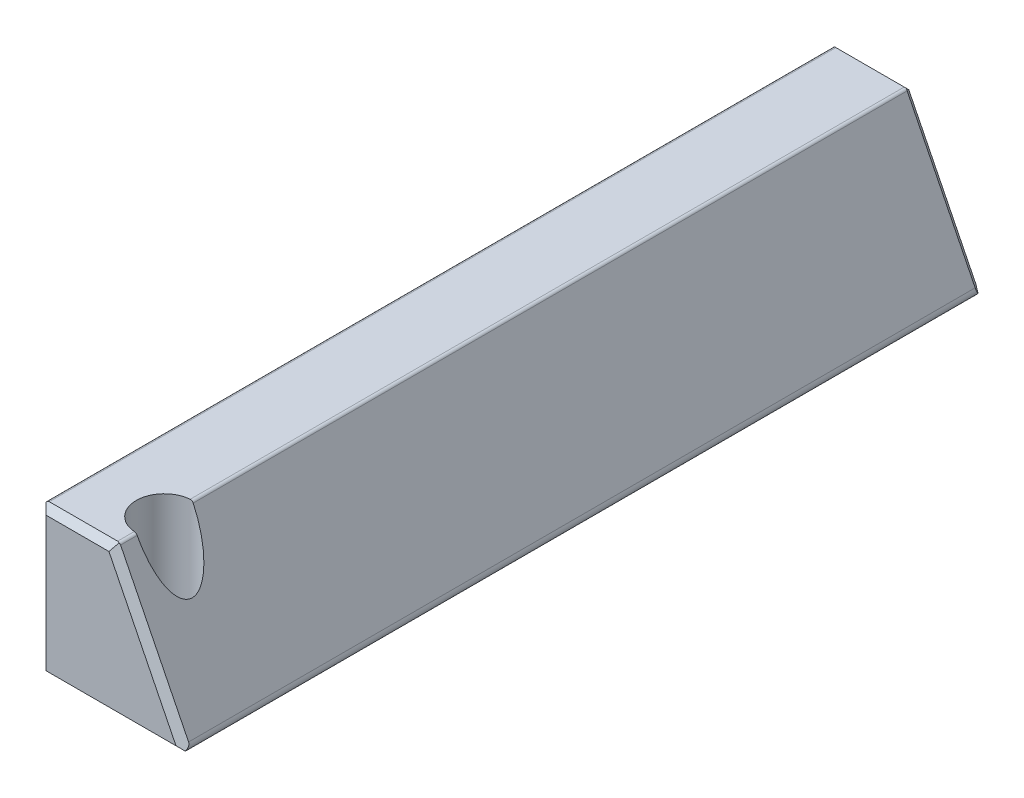
from build123d import *

# Parameters (mm, degrees)
BASE_DEPTH        = 60.25
FACE_CHAMFER_SIZE = 0.5
SMALLER_FILLETS_R = 0.25
LARGER_FILLET_R   = 0.5
SKETCH2_R         = 2.11
HOLE_DEPTH        = 63.216278519


with BuildPart() as part:
    # Sketch1 → Base (new body)
    with BuildSketch(Plane.XY):
        Polygon((0, 11.15), (0, 0), (11.1, 0), (5.55, 11.15), align=None)
    extrude(amount=BASE_DEPTH)

    # Face Chamfer
    face_chamfer_edges = [part.edges().sort_by_distance(p)[0] for p in [
        (5.55, 0, 60.25),
        (8.325, 5.575, 60.25),
        (2.775, 11.15, 60.25),
        (8.325, 5.575, 0),
        (5.55, 0, 0),
        (0, 5.575, 0),
        (2.775, 11.15, 0),
        (0, 5.575, 60.25),
    ]]
    chamfer(face_chamfer_edges, length=FACE_CHAMFER_SIZE)

    # Smaller Fillets
    smaller_fillets_edges = [part.edges().sort_by_distance(p)[0] for p in [
        (0, 0, 30.125),
        (0, 11.15, 30.125),
        (5.55, 11.15, 30.125),
    ]]
    fillet(smaller_fillets_edges, radius=SMALLER_FILLETS_R)

    # Larger Fillet
    larger_fillet_edges = [part.edges().sort_by_distance(p)[0] for p in [
        (11.1, 0, 30.125),
    ]]
    fillet(larger_fillet_edges, radius=LARGER_FILLET_R)

    # Sketch2 → Hole (cut, through all)
    with BuildSketch(Plane(origin=(0, 11.15, 0), x_dir=(1, 0, 0), z_dir=(0, 1, 0))):
        with Locations(Location((5.55, -56.39, 0), (0, 0, 180))):
            Circle(SKETCH2_R)
    extrude(amount=-HOLE_DEPTH, mode=Mode.SUBTRACT)


solid = part.part
